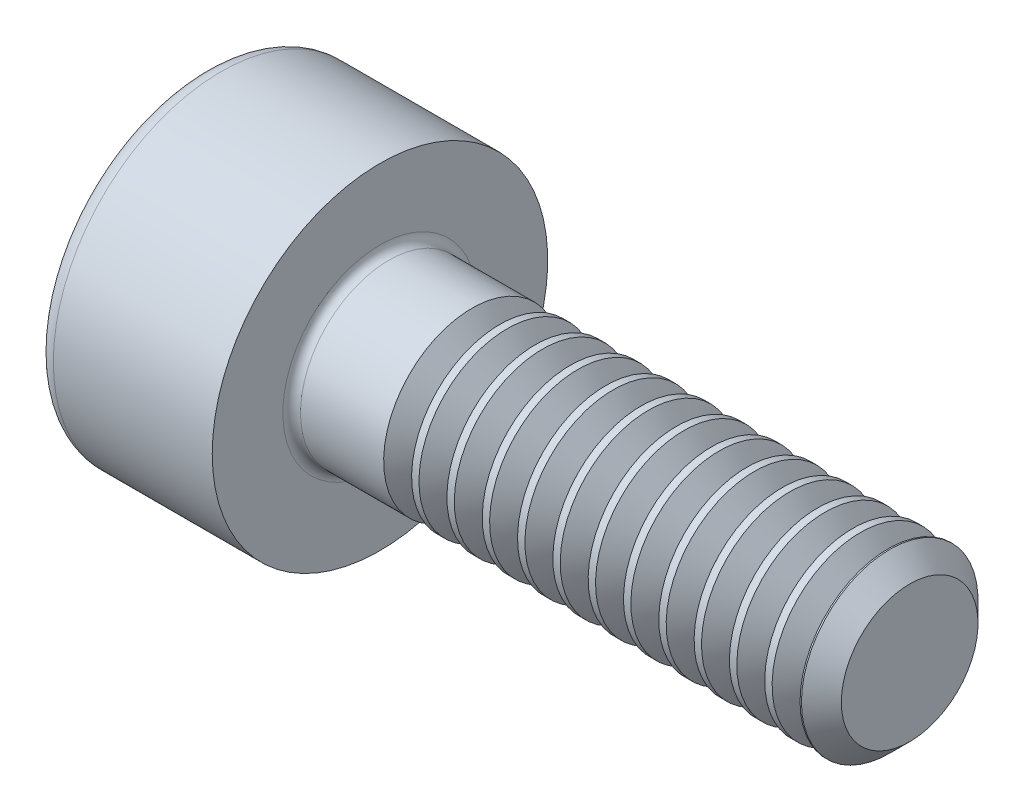
from build123d import *

# Parameters (mm, degrees)
FILLET1_R       = 0.1
FILLET2_R       = 0.2
HEX_2_DEPTH     = 1
THDSCHPAT_COUNT = 12
THDSCHPAT_PITCH = 0.4


with BuildPart() as part:
    # BodySke → Base-Revolve (revolve)
    with BuildSketch(Plane.XY, mode=Mode.PRIVATE) as base_revolve_sk:
        Polygon((0, 0), (0, 1.9), (2, 1.9), (2, 1), (7.774, 1), (8, 0.774), (8, 0), align=None)
    revolve(base_revolve_sk.sketch.rotate(Axis((-31.75, 0, 0), (1, 0, 0)), 90), axis=Axis((-31.75, 0, 0), (1, 0, 0)))

    # Fillet1
    fillet1_edges = [part.edges().sort_by_distance(p)[0] for p in [
        (2, 0, -1),
    ]]
    fillet(fillet1_edges, radius=FILLET1_R)

    # Fillet2
    fillet2_edges = [part.edges().sort_by_distance(p)[0] for p in [
        (0, 0, -1.9),
    ]]
    fillet(fillet2_edges, radius=FILLET2_R)

    # Sketch2 → Hex-PreBroach (revolve, cut)
    with BuildSketch(Plane.XY, mode=Mode.PRIVATE) as hex_prebroach_sk:
        Polygon((0, 0.76), (1, 0.76), (1.438786205, 0), (0, 0), align=None)
    revolve(hex_prebroach_sk.sketch.rotate(Axis((0, 0, 0), (1, 0, 0)), 90), axis=Axis((0, 0, 0), (1, 0, 0)), mode=Mode.SUBTRACT)

    # Sketch3 → Hex 2 (cut)
    with BuildSketch(Plane(origin=(0, 0, 0), x_dir=(0, 0.500000000000001, 0.866025403784438), z_dir=(-1, 0, 0))):
        Polygon((0.438786205, 0.76), (-0.438786205, 0.76), (-0.877572409, 0), (-0.438786205, -0.76), (0.438786205, -0.76), (0.877572409, 0), align=None)
    extrude(amount=-HEX_2_DEPTH, mode=Mode.SUBTRACT)

    # ThdSchSke → ThreadSchematic (revolve, cut)
    with BuildSketch(Plane.XY):
        Polygon((3.2, -0.774), (3.041753096, -1), (3.041753096, -1.25), (3.358246904, -1.25), (3.358246904, -1), align=None)
    threadschematic = revolve(axis=Axis((-3.175, 0, 0), (1, 0, 0)), mode=Mode.SUBTRACT)

    # ThdSchPat: ThreadSchematic ×12
    with Locations(*[(i * THDSCHPAT_PITCH, 0, 0) for i in range(1, THDSCHPAT_COUNT)]):
        add(threadschematic, mode=Mode.SUBTRACT)


solid = part.part
